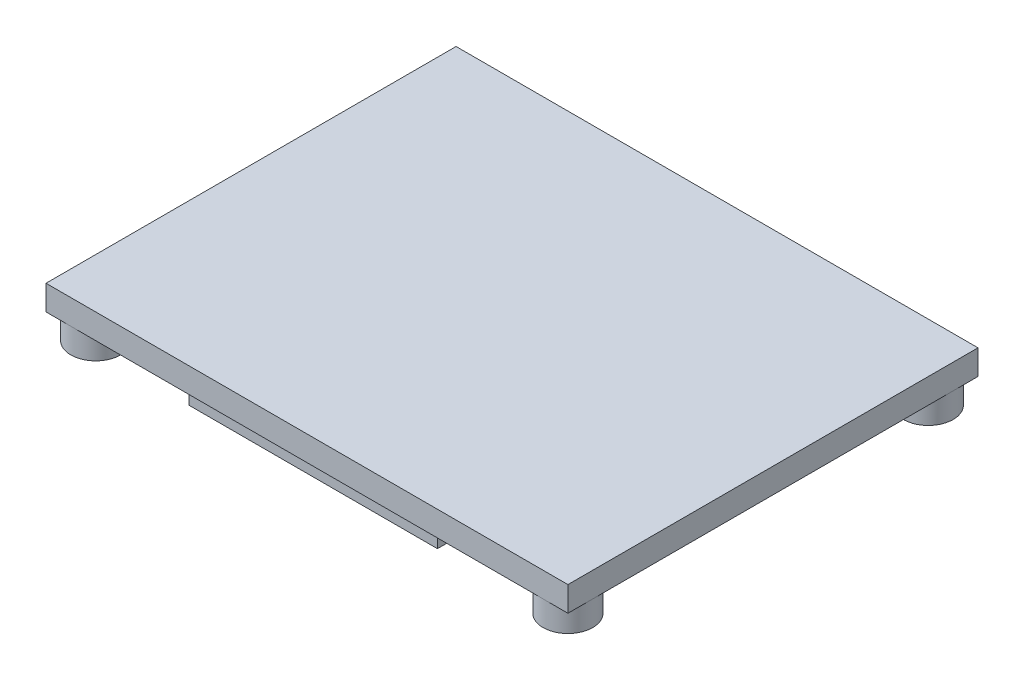
from build123d import *

# Parameters (mm, degrees)
SKETCH1_W           = 840
SKETCH1_H           = 660
BOSS_EXTRUDE1_DEPTH = 40
SKETCH2_R           = 40
BOSS_EXTRUDE2_DEPTH = 40
SKETCH3_W           = 400
SKETCH3_H           = 640
BOSS_EXTRUDE3_DEPTH = 25


with BuildPart() as part:
    # Sketch1 → Boss-Extrude1 (new body)
    with BuildSketch(Plane(origin=(0, 0, 0), x_dir=(1, 0, 0), z_dir=(0, 1, 0))):
        with Locations((420, 330)):
            Rectangle(SKETCH1_W, SKETCH1_H)
    extrude(amount=BOSS_EXTRUDE1_DEPTH)

    # Sketch2 → Boss-Extrude2 (add)
    with BuildSketch(Plane.XZ):
        with Locations(Location((40, -40, 0), (0, 0, 90))):
            Circle(SKETCH2_R)
        with Locations(Location((800, -40, 0), (0, 0, 90))):
            Circle(SKETCH2_R)
        with Locations(Location((40, -620, 0), (0, 0, 270))):
            Circle(SKETCH2_R)
        with Locations(Location((800, -620, 0), (0, 0, 270))):
            Circle(SKETCH2_R)
    extrude(amount=BOSS_EXTRUDE2_DEPTH)

    # Sketch3 → Boss-Extrude3 (add)
    with BuildSketch(Plane.XZ):
        with Locations((420, -330)):
            Rectangle(SKETCH3_W, SKETCH3_H)
    extrude(amount=BOSS_EXTRUDE3_DEPTH)


solid = part.part
